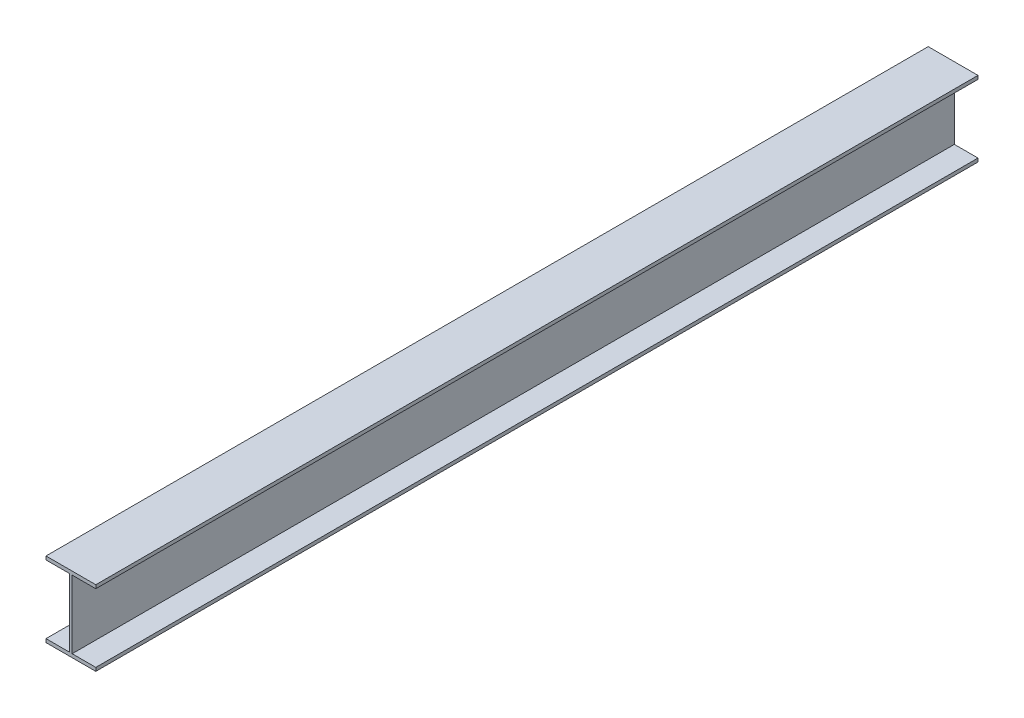
from build123d import *

# Parameters (mm, degrees)
BOSS_EXTRUDE1_DEPTH = 1800


with BuildPart() as part:
    # Sketch1 → Boss-Extrude1 (new body)
    with BuildSketch(Plane.XY):
        Polygon((0, -0.000240533), (101.6, -0.000240533), (101.6, -7.112240533), (53.408035714, -7.112240533), (53.408035714, -146.050240533), (101.6, -146.050240533), (101.6, -153.162240533), (0, -153.162240533), (0, -146.050240533), (47.566035714, -146.050240533), (47.566035714, -7.112240533), (0, -7.112240533), align=None)
    extrude(amount=BOSS_EXTRUDE1_DEPTH)


solid = part.part
